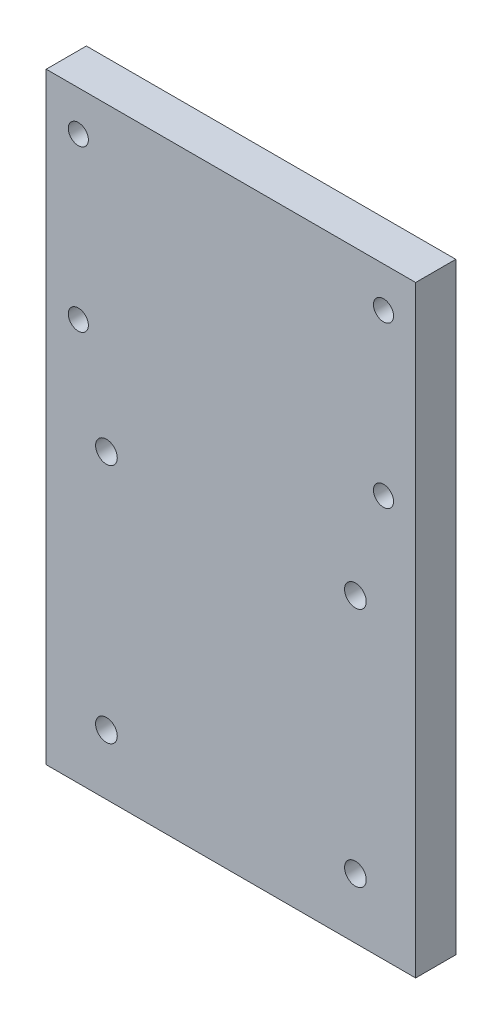
from build123d import *

# Parameters (mm, degrees)
SKETCH_1_W      = 46
SKETCH_1_H      = 75
SKETCH_1_R      = 1.25
SKETCH_1_R_2    = 1.35
EXTRUDE_1_DEPTH = 5


with BuildPart() as part:
    # 草圖1 → 填料-伸長1 (new body)
    with BuildSketch(Plane.XY):
        Rectangle(SKETCH_1_W, SKETCH_1_H)
        with Locations((-19, 32.5)):
            Circle(SKETCH_1_R, mode=Mode.SUBTRACT)
        with Locations((-15.5, -30)):
            Circle(SKETCH_1_R_2, mode=Mode.SUBTRACT)
        with Locations((-15.5, 0)):
            Circle(SKETCH_1_R_2, mode=Mode.SUBTRACT)
        with Locations((15.5, -30)):
            Circle(SKETCH_1_R_2, mode=Mode.SUBTRACT)
        with Locations((15.5, 0)):
            Circle(SKETCH_1_R_2, mode=Mode.SUBTRACT)
        with Locations((19, 32.5)):
            Circle(SKETCH_1_R, mode=Mode.SUBTRACT)
        with Locations((-19, 12.5)):
            Circle(SKETCH_1_R, mode=Mode.SUBTRACT)
        with Locations((19, 12.5)):
            Circle(SKETCH_1_R, mode=Mode.SUBTRACT)
    extrude(amount=EXTRUDE_1_DEPTH)


solid = part.part
